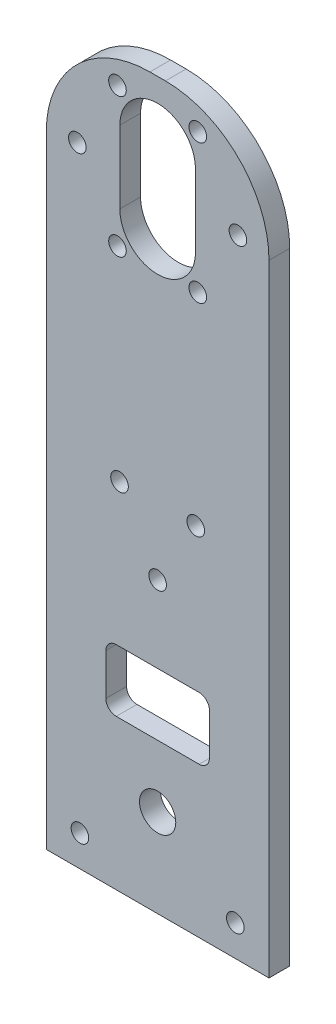
from build123d import *

# Parameters (mm, degrees)
SKETCH1_W           = 43
SKETCH1_H           = 140
SKETCH1_R           = 1.7
SKETCH1_R_2         = 3.5
BOSS_EXTRUDE1_DEPTH = 4
FILLET1_R           = 20
SKETCH2_R           = 1.7
DEPENDANT_DEPTH     = 10


with BuildPart() as part:
    # Sketch1 → Boss-Extrude1 (new body)
    with BuildSketch(Plane.XY):
        with Locations((-1, -50.2)):
            Rectangle(SKETCH1_W, SKETCH1_H)
        with Locations((6.748548523, -12.425907791)):
            Circle(SKETCH1_R, mode=Mode.SUBTRACT)
        with Locations((-8.754354431, -12.425907791)):
            Circle(SKETCH1_R, mode=Mode.SUBTRACT)
        with Locations((-16.505805908, 1)):
            Circle(SKETCH1_R, mode=Mode.SUBTRACT)
        with Locations((-8.754354431, 14.425907791)):
            Circle(SKETCH1_R, mode=Mode.SUBTRACT)
        with Locations((6.748548523, 14.425907791)):
            Circle(SKETCH1_R, mode=Mode.SUBTRACT)
        with Locations((14.5, 1)):
            Circle(SKETCH1_R, mode=Mode.SUBTRACT)
        with Locations((14, -114.2)):
            Circle(SKETCH1_R, mode=Mode.SUBTRACT)
        with Locations((-16, -114.2)):
            Circle(SKETCH1_R, mode=Mode.SUBTRACT)
        with Locations((-1, -103.2)):
            Circle(SKETCH1_R_2, mode=Mode.SUBTRACT)
        with BuildLine():
            Line((6.3, 8), (6.3, -6))
            ThreePointArc((6.3, -6), (-1, -13.3), (-8.3, -6))
            Line((-8.3, -6), (-8.3, 8))
            ThreePointArc((-8.3, 8), (-1, 15.3), (6.3, 8))
        make_face(mode=Mode.SUBTRACT)
        with BuildLine():
            Line((-9, -91.2), (7, -91.2))
            ThreePointArc((7, -91.2), (8.414213562, -90.614213562), (9, -89.2))
            Line((9, -89.2), (9, -81.2))
            ThreePointArc((9, -81.2), (8.414213562, -79.785786438), (7, -79.2))
            Line((7, -79.2), (-9, -79.2))
            ThreePointArc((-9, -79.2), (-10.414213562, -79.785786438), (-11, -81.2))
            Line((-11, -81.2), (-11, -89.2))
            ThreePointArc((-11, -89.2), (-10.414213562, -90.614213562), (-9, -91.2))
        make_face(mode=Mode.SUBTRACT)
    extrude(amount=BOSS_EXTRUDE1_DEPTH)

    # Fillet1
    fillet1_edges = [part.edges().sort_by_distance(p)[0] for p in [
        (-22.5, 19.8, 2),
        (20.5, 19.8, 2),
    ]]
    fillet(fillet1_edges, radius=FILLET1_R)

    # Sketch2 → dependant (cut)
    with BuildSketch(Plane.XY.offset(4)):
        with Locations((-1, -64.401659044)):
            Circle(SKETCH2_R)
        with Locations((6.361215932, -51.651659044)):
            Circle(SKETCH2_R)
        with Locations((-8.361215932, -51.651659044)):
            Circle(SKETCH2_R)
    extrude(amount=-DEPENDANT_DEPTH, mode=Mode.SUBTRACT)


solid = part.part
